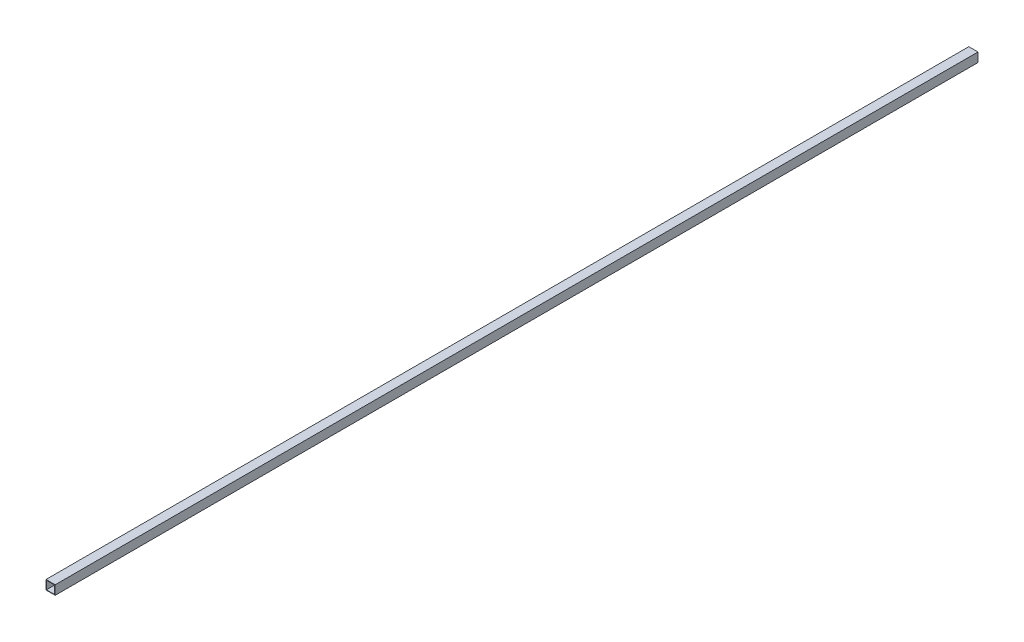
from build123d import *

# Parameters (mm, degrees)
CROQUIS1_W            = 20
CROQUIS1_H            = 20
CROQUIS1_W_2          = 18
CROQUIS1_H_2          = 18
EXTRUIR_L_MINA1_DEPTH = 1005


with BuildPart() as part:
    # Croquis1 → Extruir-Lámina1 (new, symmetric)
    with BuildSketch(Plane.XY):
        Rectangle(CROQUIS1_W, CROQUIS1_H)
        Rectangle(CROQUIS1_W_2, CROQUIS1_H_2, mode=Mode.SUBTRACT)
    extrude(amount=EXTRUIR_L_MINA1_DEPTH, both=True)


solid = part.part
